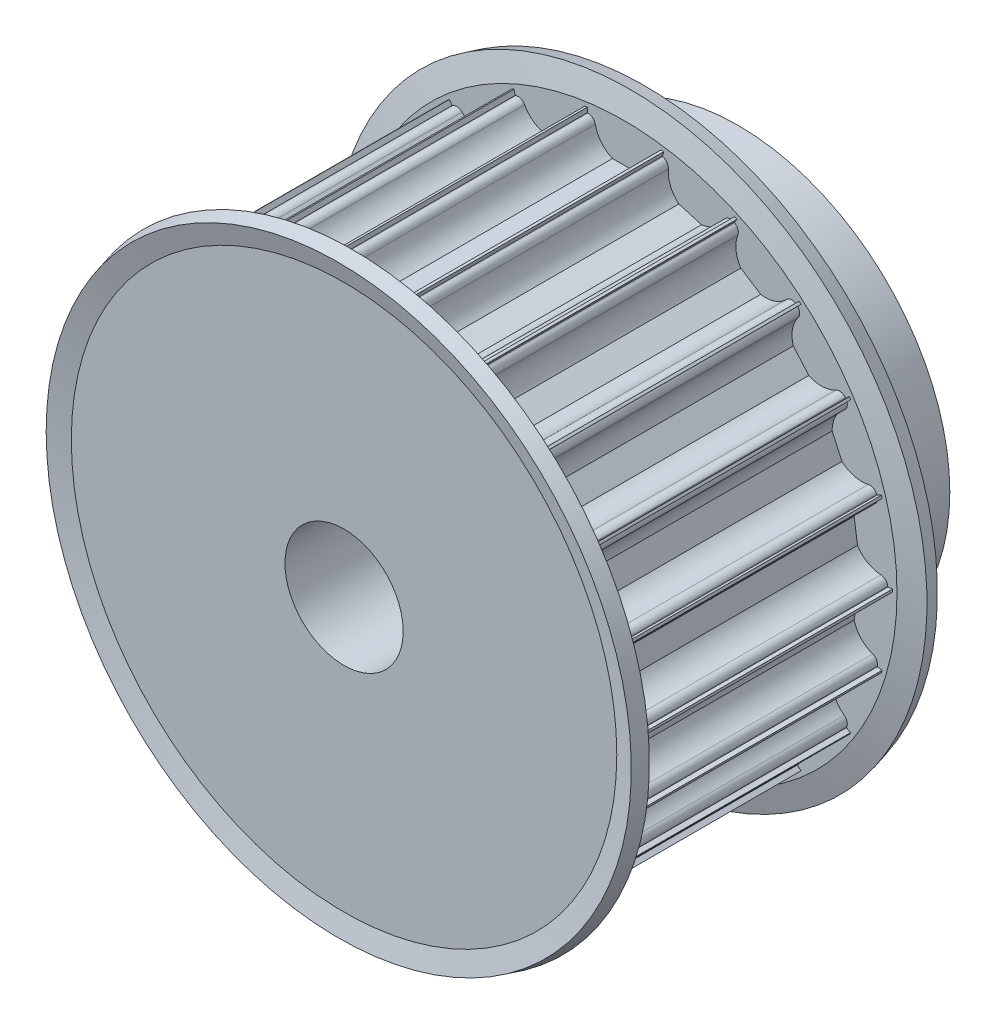
from build123d import *

# Parameters (mm, degrees)
CUT_EXTRUDE1_REACH = 57.544
CIRPATTERN1_COUNT  = 22


with BuildPart() as part:
    # Sketch1 → Revolve1 (revolve)
    with BuildSketch(Plane(origin=(0, 0, 0), x_dir=(0, 0, -1), z_dir=(1, 0, 0)), mode=Mode.PRIVATE) as revolve1_sk:
        Polygon((0, 6), (40, 6), (40, 21.5), (30, 21.5), (30, 27.25), (0, 27.25), align=None)
    revolve(revolve1_sk.sketch.rotate(Axis((0, 0, 0), (0, 0, -1)), 90), axis=Axis((0, 0, 0), (0, 0, -1)))

    # Sketch2 → Cut-Extrude1 (cut, up to next)
    with BuildSketch(Plane.XY, mode=Mode.PRIVATE) as cut_extrude1_sk1:
        with BuildLine():
            Line((-3.674234614, 26.5), (-3.75, 26.5))
            Line((-3.75, 26.5), (-3.75, 28.5))
            Line((-3.75, 28.5), (3.75, 28.5))
            Line((3.75, 28.5), (3.75, 26.5))
            Line((3.75, 26.5), (3.674234614, 26.5))
            ThreePointArc((3.674234614, 26.5), (3.199892965, 26.330947502), (2.939387691, 25.9))
            ThreePointArc((2.939387691, 25.9), (2.331759211, 24.612435701), (1.198957881, 23.75))
            Line((1.198957881, 23.75), (-1.198957881, 23.75))
            ThreePointArc((-1.198957881, 23.75), (-2.331759211, 24.612435701), (-2.939387691, 25.9))
            ThreePointArc((-2.939387691, 25.9), (-3.199892965, 26.330947502), (-3.674234614, 26.5))
        make_face()
    cut_extrude1_tool1 = extrude(cut_extrude1_sk1.sketch, amount=-CUT_EXTRUDE1_REACH, mode=Mode.PRIVATE) & part.part
    cut_extrude1 = cut_extrude1_tool1.solids().sort_by_distance((0, 26.435169, 0))[0]
    add(cut_extrude1, mode=Mode.SUBTRACT)

    # CirPattern1: Cut-Extrude1 ×22 about axis
    cirpattern1_axis = Axis((0, 0, 0), (0, 0, 1))
    for i in range(1, CIRPATTERN1_COUNT):
        add(cut_extrude1.rotate(cirpattern1_axis, i * 360 / CIRPATTERN1_COUNT), mode=Mode.SUBTRACT)

    # Sketch3 → Revolve4 (revolve)
    with BuildSketch(Plane(origin=(0, 0, 0), x_dir=(0, 0, -1), z_dir=(1, 0, 0)), mode=Mode.PRIVATE) as revolve4_sk:
        Polygon((30, 21.5), (30, 27.69), (30.539052531, 29.701771432), (29.090163791, 30.09), (28.447085729, 27.69), (28.447085729, 21.5), align=None)
        Polygon((1.552914271, 27.69), (1.552914271, 21.5), (0, 21.5), (0, 27.69), (-0.539052531, 29.701771432), (0.909836209, 30.09), align=None)
    revolve(revolve4_sk.sketch.rotate(Axis((0, 0, 0), (0, 0, 1)), 90), axis=Axis((0, 0, 0), (0, 0, 1)))


solid = part.part
